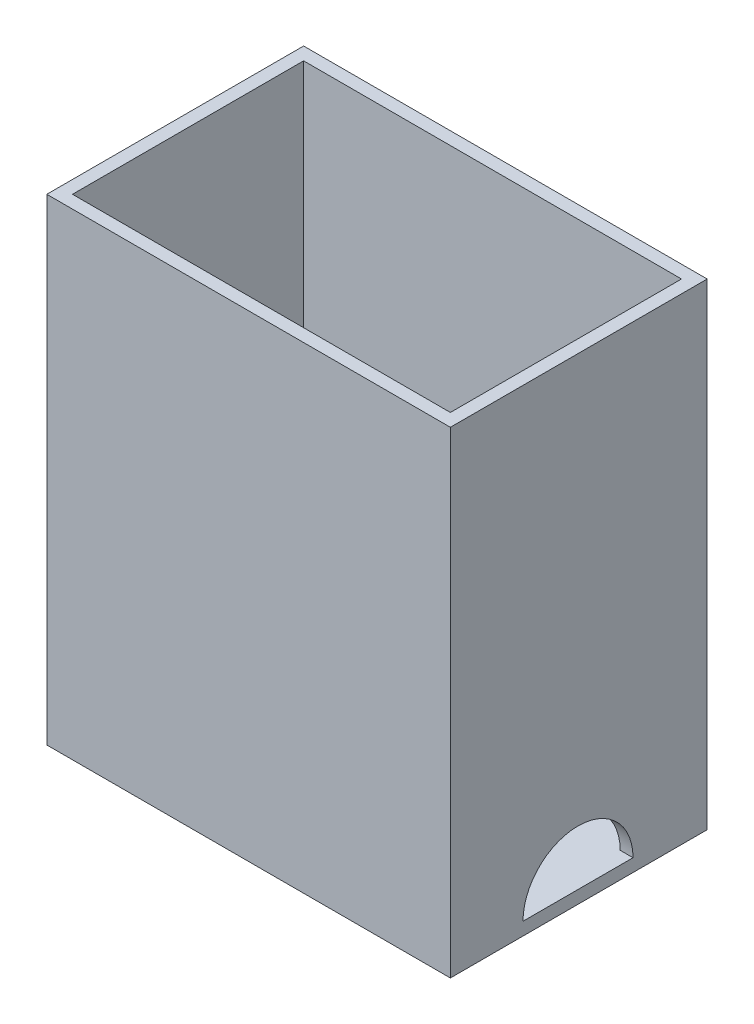
from build123d import *

# Parameters (mm, degrees)
CROQUIS1_W                 = 110
CROQUIS1_H                 = 70
SALIENTE_EXTRUIR3_DEPTH    = 130
VACIADO4_T                 = -3.5
CORTAR_EXTRUIR4_REACH      = 147.43
CROQUIS2_R                 = 6
CROQUIS2_R_2               = 1.5
CORTAR_EXTRUIR8_DEPTH      = 174.853386507
CORTAR_EXTRUIR8_DEPTH_BACK = 174.853386507


with BuildPart() as part:
    # Croquis1 → Saliente-Extruir3 (new body)
    with BuildSketch(Plane(origin=(0, 0, 0), x_dir=(1, 0, 0), z_dir=(0, 1, 0))):
        Rectangle(CROQUIS1_W, CROQUIS1_H)
    extrude(amount=SALIENTE_EXTRUIR3_DEPTH)

    # Vaciado4
    vaciado4_openings = [part.faces().sort_by_distance(p)[0] for p in [
        (0, 130, 0),
    ]]
    offset(amount=VACIADO4_T, openings=vaciado4_openings, kind=Kind.INTERSECTION)

    # Croquis2 → Cortar-Extruir4 (cut, up to next)
    with BuildSketch(Plane(origin=(0, 0, 0), x_dir=(1, 0, 0), z_dir=(0, 1, 0)), mode=Mode.PRIVATE) as cortar_extruir4_sk1:
        with Locations(Location((-24.5, 0, 0), (0, 0, 270))):
            Circle(CROQUIS2_R)
    cortar_extruir4_tool1 = extrude(cortar_extruir4_sk1.sketch, amount=CORTAR_EXTRUIR4_REACH, mode=Mode.PRIVATE) & part.part
    # Croquis2 → Cortar-Extruir4 (cut, up to next)
    with BuildSketch(Plane(origin=(0, 0, 0), x_dir=(1, 0, 0), z_dir=(0, 1, 0)), mode=Mode.PRIVATE) as cortar_extruir4_sk2:
        with Locations(Location((24.5, 0, 0), (0, 0, 270))):
            Circle(CROQUIS2_R)
    cortar_extruir4_tool2 = extrude(cortar_extruir4_sk2.sketch, amount=CORTAR_EXTRUIR4_REACH, mode=Mode.PRIVATE) & part.part
    # Croquis2 → Cortar-Extruir4 (cut, up to next)
    with BuildSketch(Plane(origin=(0, 0, 0), x_dir=(1, 0, 0), z_dir=(0, 1, 0)), mode=Mode.PRIVATE) as cortar_extruir4_sk3:
        with Locations(Location((0, 0, 0), (0, 0, 270))):
            Circle(CROQUIS2_R_2)
    cortar_extruir4_tool3 = extrude(cortar_extruir4_sk3.sketch, amount=CORTAR_EXTRUIR4_REACH, mode=Mode.PRIVATE) & part.part
    add(cortar_extruir4_tool1.solids().sort_by_distance((-24.5, 0, 0))[0], mode=Mode.SUBTRACT)
    add(cortar_extruir4_tool2.solids().sort_by_distance((24.5, 0, 0))[0], mode=Mode.SUBTRACT)
    add(cortar_extruir4_tool3.solids().sort_by_distance((0, 0, 0))[0], mode=Mode.SUBTRACT)

    # Croquis3 → Cortar-Extruir8 (cut, two sides: drawn at the far end of the back side and taken through both)
    with BuildSketch(Plane(origin=(55, 0, 0), x_dir=(0, 0, -1), z_dir=(1, 0, 0)).offset(-CORTAR_EXTRUIR8_DEPTH_BACK)):
        with BuildLine():
            Line((-15.212730717, 3.5), (14.783786757, 3.5))
            ThreePointArc((14.783786757, 3.5), (10.390898479, 14.105370459), (-0.21447198, 18.498258737))
            ThreePointArc((-0.21447198, 18.498258737), (-10.819842439, 14.105370459), (-15.212730717, 3.5))
        make_face()
    extrude(amount=CORTAR_EXTRUIR8_DEPTH + CORTAR_EXTRUIR8_DEPTH_BACK, mode=Mode.SUBTRACT)


solid = part.part
